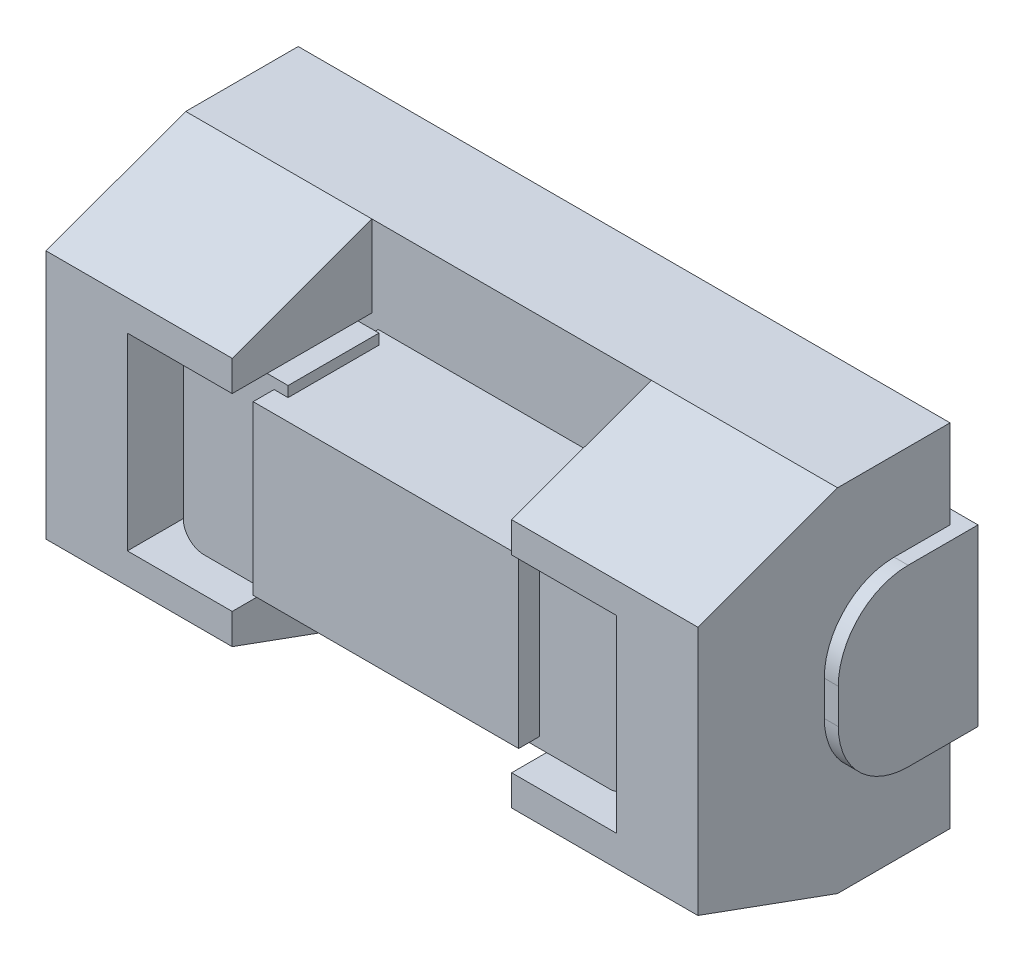
from build123d import *
from OCP.BRepFilletAPI import BRepFilletAPI_MakeChamfer

# Parameters (mm, degrees)
BOSS_EXTRUDE1_START  = 0.2
SKETCH1_W            = 9.33
SKETCH1_H            = 5.03
BOSS_EXTRUDE1_DEPTH  = 3.61
CUT_EXTRUDE1_DEPTH   = 2
CHAMFER1_SIZE        = 2
CHAMFER1_SIZE2       = 0.727940469
BOSS_EXTRUDE3_DEPTH  = 1.25
FILLET2_R            = 1
FILLET2_OF_MIRROR1_R = 1
BOSS_EXTRUDE4_START  = 0.2
SKETCH7_W            = 1.5
SKETCH7_H            = 2.7
BOSS_EXTRUDE4_DEPTH  = 1.3
FILLET3_R            = 0.3
BOSS_EXTRUDE5_START  = -1.49
SKETCH8_W            = 3.8
SKETCH8_H            = 2.4
BOSS_EXTRUDE5_DEPTH  = 1.79


with BuildPart() as part:
    # Sketch1 → Boss-Extrude1 (new body)
    with BuildSketch(Plane.XY.offset(BOSS_EXTRUDE1_START)):
        Rectangle(SKETCH1_W, SKETCH1_H)
    extrude(amount=BOSS_EXTRUDE1_DEPTH)

    # Sketch2 → Cut-Extrude1 (cut)
    with BuildSketch(Plane.XY.offset(3.81)):
        Polygon((-3.5, 1.35), (-2, 1.35), (-2, 2.515), (2, 2.515), (2, 1.35), (3.5, 1.35), (3.5, -1.35), (2, -1.35), (2, -2.515), (-2, -2.515), (-2, -1.35), (-3.5, -1.35), align=None)
    extrude(amount=-CUT_EXTRUDE1_DEPTH, mode=Mode.SUBTRACT)

    # Chamfer1: one chamfer whose edges measure the first distance from different faces: ONE call of the kernel's chamfer builder (chamfer() names one face for all edges)
    chamfer1_edges_1 = [part.edges().sort_by_distance(p)[0] for p in [
        (-3.3325, 2.515, 3.81),
        (3.3325, 2.515, 3.81),
    ]]
    chamfer1_side_1 = [part.faces().sort_by_distance(p)[0] for p in [
        (0, 2.515, 1.754233878),
    ]]
    chamfer1_edges_2 = [part.edges().sort_by_distance(p)[0] for p in [
        (3.3325, -2.515, 3.81),
        (-3.3325, -2.515, 3.81),
    ]]
    chamfer1_side_2 = [part.faces().sort_by_distance(p)[0] for p in [
        (0, -2.515, 1.754233878),
    ]]
    chamfer1 = BRepFilletAPI_MakeChamfer(part.part.solid().wrapped)
    for e in chamfer1_edges_1:
        chamfer1.Add(CHAMFER1_SIZE, CHAMFER1_SIZE2, e.wrapped, chamfer1_side_1[0].wrapped)  # the first distance lies on this face
    for e in chamfer1_edges_2:
        chamfer1.Add(CHAMFER1_SIZE, CHAMFER1_SIZE2, e.wrapped, chamfer1_side_2[0].wrapped)  # the first distance lies on this face
    add(Compound.cast(chamfer1.Shape()), mode=Mode.REPLACE)

    # Sketch6 → Boss-Extrude3 (add, symmetric)
    with BuildSketch(Plane(origin=(0, 0, 0), x_dir=(1, 0, 0), z_dir=(0, 1, 0))):
        Polygon((4.665, -2), (4.865, -2), (4.865, 0), (1, 0), (1, -0.2), (4.665, -0.2), align=None)
    boss_extrude3 = extrude(amount=BOSS_EXTRUDE3_DEPTH, both=True)

    # Fillet2
    fillet2_edges = [part.edges().sort_by_distance(p)[0] for p in [
        (4.765, -1.25, 2),
        (4.765, 1.25, 2),
    ]]
    fillet(fillet2_edges, radius=FILLET2_R)

    # Mirror1: Boss-Extrude3 across plane
    add(boss_extrude3.mirror(Plane(origin=(0, 0, 0), x_dir=(0, 0, 1), z_dir=(1, 0, 0))))

    # Fillet2 of Mirror1
    fillet2_of_mirror1_edges = [part.edges().sort_by_distance(p)[0] for p in [
        (-4.765, -1.25, 2),
        (-4.765, 1.25, 2),
    ]]
    fillet(fillet2_of_mirror1_edges, radius=FILLET2_OF_MIRROR1_R)



with BuildPart() as body_2:
    # Sketch7 → Boss-Extrude4 (new body)
    with BuildSketch(Plane.XY.offset(1.81).offset(BOSS_EXTRUDE4_START)):
        with Locations((-2.45, 0)):
            Rectangle(SKETCH7_W, SKETCH7_H)
    extrude(amount=BOSS_EXTRUDE4_DEPTH)

    # Fillet3
    fillet3_edges = [body_2.edges().sort_by_distance(p)[0] for p in [
        (-3.2, 1.35, 2.66),
        (-3.2, -1.35, 2.66),
    ]]
    fillet(fillet3_edges, radius=FILLET3_R)


with BuildPart() as body_3:
    # Mirror2: mirrored copy
    add(body_2.part.mirror(Plane(origin=(0, 0, 0), x_dir=(0, 0, 1), z_dir=(1, 0, 0))))


with BuildPart() as part_1:
    add(part.part)

    add(body_2.part)  # Boss-Extrude5 merges body 2

    add(body_3.part)  # Boss-Extrude5 merges body 3
    # Sketch8 → Boss-Extrude5 (add)
    with BuildSketch(Plane.XY.offset(3.31).offset(BOSS_EXTRUDE5_START)):
        Rectangle(SKETCH8_W, SKETCH8_H)
    extrude(amount=BOSS_EXTRUDE5_DEPTH)


solid = part_1.part
